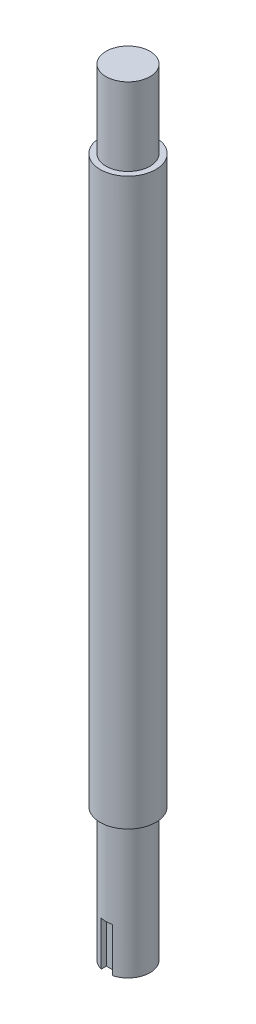
from build123d import *

# Parameters (mm, degrees)
SKETCH1_R           = 15.875
BOSS_EXTRUDE1_DEPTH = 215.9
SKETCH4_R           = 15.875
SKETCH4_R_2         = 12.588875
CUT_EXTRUDE3_DEPTH  = 69.85
CUT_EXTRUDE4_START  = -38.1
SKETCH5_R           = 15.875
SKETCH5_R_2         = 12.588875
CUT_EXTRUDE4_DEPTH  = 38.1
SKETCH7_R           = 12.588875
BOSS_EXTRUDE2_DEPTH = 38.1
SKETCH8_W           = 6.35
SKETCH8_H           = 6.477
CUT_EXTRUDE5_DEPTH  = 25.4
SKETCH9_R           = 12.588875
CUT_EXTRUDE6_DEPTH  = 25.4


with BuildPart() as part:
    # Sketch1 → Boss-Extrude1 (new, symmetric)
    with BuildSketch(Plane(origin=(0, 0, 0), x_dir=(1, 0, 0), z_dir=(0, 1, 0))):
        with Locations(Location((0, 0, 0), (0, 0, 270))):
            Circle(SKETCH1_R)
    extrude(amount=BOSS_EXTRUDE1_DEPTH, both=True)

    # Sketch4 → Cut-Extrude3 (cut)
    with BuildSketch(Plane(origin=(0, 215.9, 0), x_dir=(1, 0, 0), z_dir=(0, 1, 0))):
        with Locations(Location((0, 0, 0), (0, 0, 270))):
            Circle(SKETCH4_R)
        with Locations(Location((0, 0, 0), (0, 0, 270))):
            Circle(SKETCH4_R_2, mode=Mode.SUBTRACT)
    extrude(amount=-CUT_EXTRUDE3_DEPTH, mode=Mode.SUBTRACT)

    # Sketch5 → Cut-Extrude4 (cut)
    with BuildSketch(Plane.XZ.offset(215.9).offset(CUT_EXTRUDE4_START)):
        with Locations(Location((0, 0, 0), (0, 0, 270))):
            Circle(SKETCH5_R)
        with Locations(Location((0, 0, 0), (0, 0, 90))):
            Circle(SKETCH5_R_2, mode=Mode.SUBTRACT)
    extrude(amount=CUT_EXTRUDE4_DEPTH, mode=Mode.SUBTRACT)

    # Sketch7 → Boss-Extrude2 (add)
    with BuildSketch(Plane.XZ.offset(215.9)):
        with Locations(Location((0, 0, 0), (0, 0, 90))):
            Circle(SKETCH7_R)
    extrude(amount=BOSS_EXTRUDE2_DEPTH)

    # Sketch8 → Cut-Extrude5 (cut)
    with BuildSketch(Plane.XZ.offset(254)):
        with Locations((0, 12.468225)):
            Rectangle(SKETCH8_W, SKETCH8_H)
    extrude(amount=-CUT_EXTRUDE5_DEPTH, mode=Mode.SUBTRACT)

    # Sketch9 → Cut-Extrude6 (cut)
    with BuildSketch(Plane(origin=(0, 215.9, 0), x_dir=(1, 0, 0), z_dir=(0, 1, 0))):
        with Locations(Location((0, 0, 0), (0, 0, 270))):
            Circle(SKETCH9_R)
    extrude(amount=-CUT_EXTRUDE6_DEPTH, mode=Mode.SUBTRACT)


solid = part.part
